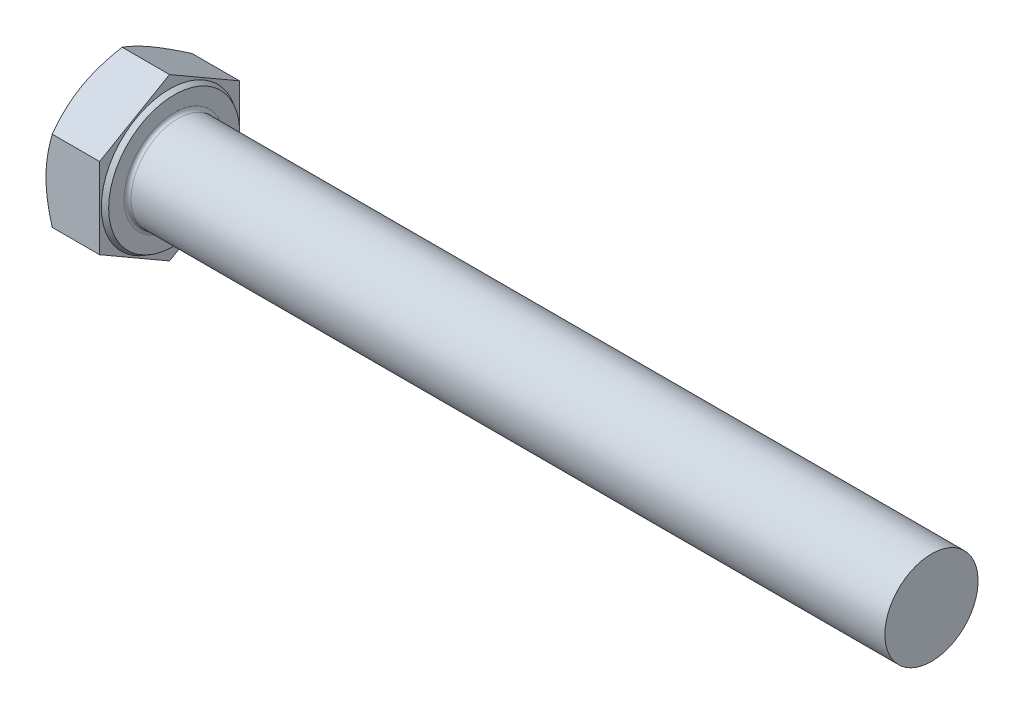
from build123d import *

# Parameters (mm, degrees)
EXTRUDE_390_DEPTH = 10
FILLET_1283_R     = 0.6


with BuildPart() as part:
    # 草图1 → Extrude 390 (new body)
    with BuildSketch(Plane(origin=(0, 0, 0), x_dir=(0, 0, -1), z_dir=(1, 0, 0))):
        Polygon((12, 6.92820323), (12, -6.92820323), (0, -13.856406461), (-12, -6.92820323), (-12, 6.92820323), (0, 13.856406461), align=None)
    extrude(amount=EXTRUDE_390_DEPTH)

    # 草图2 → 凸台-旋转1 (revolve)
    with BuildSketch(Plane.XY, mode=Mode.PRIVATE) as revolve_1_sk:
        Polygon((0, 0), (140, 0), (140, 6.268), (140, 8), (96, 8), (0, 8), align=None)
    revolve(revolve_1_sk.sketch.rotate(Axis((0, 0, 0), (1, 0, 0)), 90), axis=Axis((0, 0, 0), (1, 0, 0)))

    # 草图3 → 切除-旋转1 (revolve, cut)
    with BuildSketch(Plane.XY):
        Polygon((0, 12), (3.958548116, 18.856406461), (3.958548116, 23.856406461), (-10, 23.856406461), (-10, 12), align=None)
    revolve(axis=Axis((0, 0, 0), (1, 0, 0)), mode=Mode.SUBTRACT)

    # 草图4 → 切除-旋转3 (revolve, cut)
    with BuildSketch(Plane.XY, mode=Mode.PRIVATE) as cut_revolve_3_sk:
        Polygon((10, 11.245), (9.2, 11.706880215), (9.2, 13.856406461), (10, 13.856406461), align=None)
    revolve(cut_revolve_3_sk.sketch.rotate(Axis((0, 0, 0), (1, 0, 0)), 90), axis=Axis((0, 0, 0), (1, 0, 0)), mode=Mode.SUBTRACT)

    # Fillet 1283
    fillet_1283_edges = [part.edges().sort_by_distance(p)[0] for p in [
        (10, 0, -8),
    ]]
    fillet(fillet_1283_edges, radius=FILLET_1283_R)


solid = part.part
